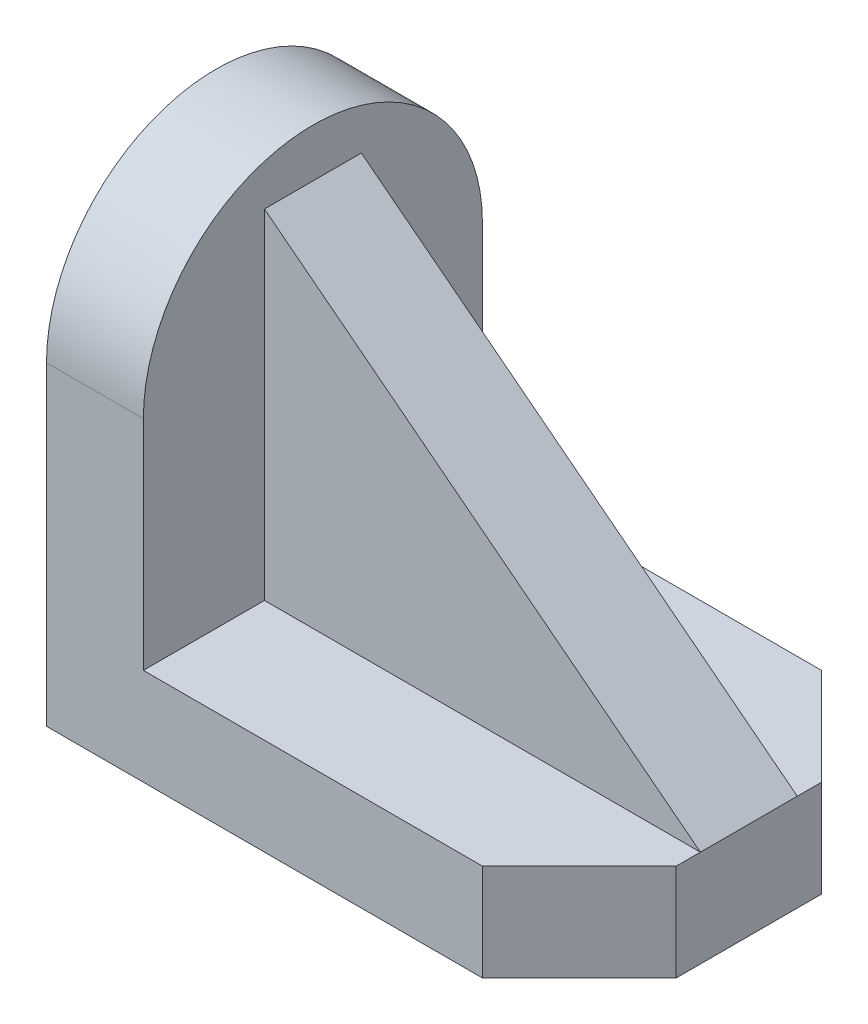
from build123d import *

# Parameters (mm, degrees)
SKETCH1_W            = 66
SKETCH1_H            = 42
BOSS_EXTRUDE1_DEPTH  = 12
CHAMFER1_SIZE        = 12
SKETCH3_W            = 12
SKETCH3_H            = 48
BOSS_EXTRUDE2_DEPTH  = 42
FILLET1_RADIUS       = 21
FILLET1_LENGTH       = 12
BOSS_EXTRUDE10_DEPTH = 6


with BuildPart() as part:
    # Sketch1 → Boss-Extrude1 (new body)
    with BuildSketch(Plane(origin=(0, 0, 0), x_dir=(1, 0, 0), z_dir=(0, 1, 0))):
        Rectangle(SKETCH1_W, SKETCH1_H)
    extrude(amount=BOSS_EXTRUDE1_DEPTH)

    # Chamfer1
    chamfer1_edges = [part.edges().sort_by_distance(p)[0] for p in [
        (33, 6, 21),
        (33, 6, -21),
    ]]
    chamfer(chamfer1_edges, length=CHAMFER1_SIZE)

    # Sketch3 → Boss-Extrude2 (add)
    with BuildSketch(Plane.XY.offset(21)):
        with Locations((-27, 36)):
            Rectangle(SKETCH3_W, SKETCH3_H)
    extrude(amount=-BOSS_EXTRUDE2_DEPTH)

    # Fillet1: full round fillet: the end face becomes a half cylinder, R = half its width
    fillet1_face = Plane((-27, 60, 0), x_dir=(-1, 0, 0), z_dir=(0, 1, 0))  # on the end face: x along it, z out of the body
    fillet1_slab = fillet1_face.offset(-FILLET1_RADIUS / 2) * Box(FILLET1_LENGTH, 2 * FILLET1_RADIUS, FILLET1_RADIUS, mode=Mode.PRIVATE)  # the body's end, R deep
    fillet1_round = Plane((-27, 39, 0), x_dir=(0, 1, 0), z_dir=(-1, 0, 0)) * Cylinder(FILLET1_RADIUS, FILLET1_LENGTH, mode=Mode.PRIVATE)  # its axis R under the face
    add(fillet1_slab - fillet1_round, mode=Mode.SUBTRACT)

    # Sketch10 → Boss-Extrude10 (add, symmetric)
    with BuildSketch(Plane.XY):
        Polygon((-21, 54), (33, 12), (-21, 12), align=None)
    extrude(amount=BOSS_EXTRUDE10_DEPTH, both=True)


solid = part.part
